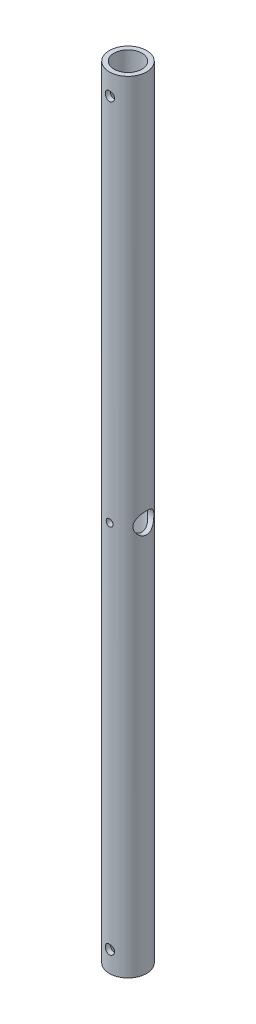
from build123d import *

# Parameters (mm, degrees)
SKETCH1_R               = 8
SKETCH1_R_2             = 6
BOSS_EXTRUDE1_DEPTH     = 168
CUT_EXTRUDE1_DEPTH      = 169.380521439
CUT_EXTRUDE1_DEPTH_BACK = 169.380521439
SKETCH2_R               = 4.5
CUT_EXTRUDE2_DEPTH      = 169.380521548
CUT_EXTRUDE2_DEPTH_BACK = 169.380521548
SKETCH3_R               = 1.5
CUT_EXTRUDE3_DEPTH      = 169.38052155
CUT_EXTRUDE3_DEPTH_BACK = 169.38052155
SKETCH4_R               = 2


with BuildPart() as part:
    # Sketch1 → Boss-Extrude1 (new, symmetric)
    with BuildSketch(Plane(origin=(0, 0, 0), x_dir=(1, 0, 0), z_dir=(0, 1, 0))):
        with Locations(Location((0, 0, 0), (0, 0, 90))):
            Circle(SKETCH1_R)
        with Locations(Location((0, 0, 0), (0, 0, 90))):
            Circle(SKETCH1_R_2, mode=Mode.SUBTRACT)
    extrude(amount=BOSS_EXTRUDE1_DEPTH, both=True)

    # Sketch2 → Cut-Extrude1 (cut, two sides: drawn at the far end of the back side and taken through both)
    with BuildSketch(Plane(origin=(0, 0, 0), x_dir=(0, 0, -1), z_dir=(1, 0, 0)).offset(-CUT_EXTRUDE1_DEPTH_BACK)):
        Circle(SKETCH2_R)
    extrude(amount=CUT_EXTRUDE1_DEPTH + CUT_EXTRUDE1_DEPTH_BACK, mode=Mode.SUBTRACT)

    # Sketch3 → Cut-Extrude2 (cut, two sides: drawn at the far end of the back side and taken through both)
    with BuildSketch(Plane.XY.offset(-CUT_EXTRUDE2_DEPTH_BACK)):
        Circle(SKETCH3_R)
    extrude(amount=CUT_EXTRUDE2_DEPTH + CUT_EXTRUDE2_DEPTH_BACK, mode=Mode.SUBTRACT)

    # Sketch4 → Cut-Extrude3 (cut, two sides: drawn at the far end of the back side and taken through both)
    with BuildSketch(Plane.XY.offset(-CUT_EXTRUDE3_DEPTH_BACK)):
        with Locations((0, 159)):
            Circle(SKETCH4_R)
        with Locations((0, -159)):
            Circle(SKETCH4_R)
    extrude(amount=CUT_EXTRUDE3_DEPTH + CUT_EXTRUDE3_DEPTH_BACK, mode=Mode.SUBTRACT)


solid = part.part
